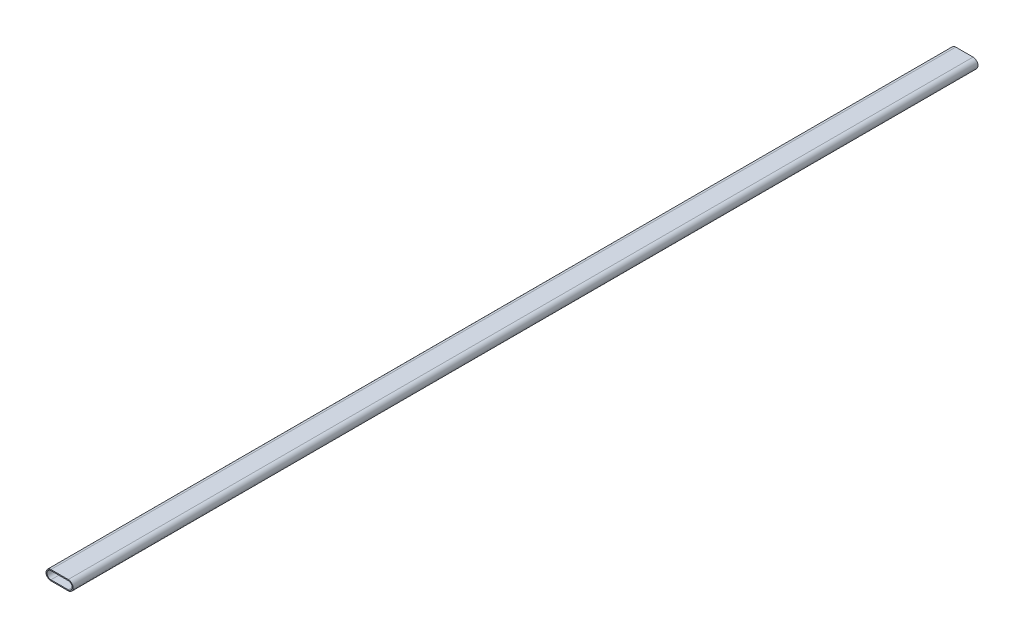
from build123d import *

# Parameters (mm, degrees)
BOSS_EXTRUDE1_DEPTH = 1100


with BuildPart() as part:
    # Sketch1 → Boss-Extrude1 (new body)
    with BuildSketch(Plane.XY):
        with BuildLine():
            Line((0, 6), (21, 6))
            ThreePointArc((21, 6), (27, 0), (21, -6))
            Line((21, -6), (0, -6))
            ThreePointArc((0, -6), (-6, 0), (0, 6))
        make_face()
        with BuildLine():
            Line((0, 4.8), (21, 4.8))
            ThreePointArc((21, 4.8), (25.8, 0), (21, -4.8))
            Line((21, -4.8), (0, -4.8))
            ThreePointArc((0, -4.8), (-4.8, 0), (0, 4.8))
        make_face(mode=Mode.SUBTRACT)
    extrude(amount=BOSS_EXTRUDE1_DEPTH)


solid = part.part
